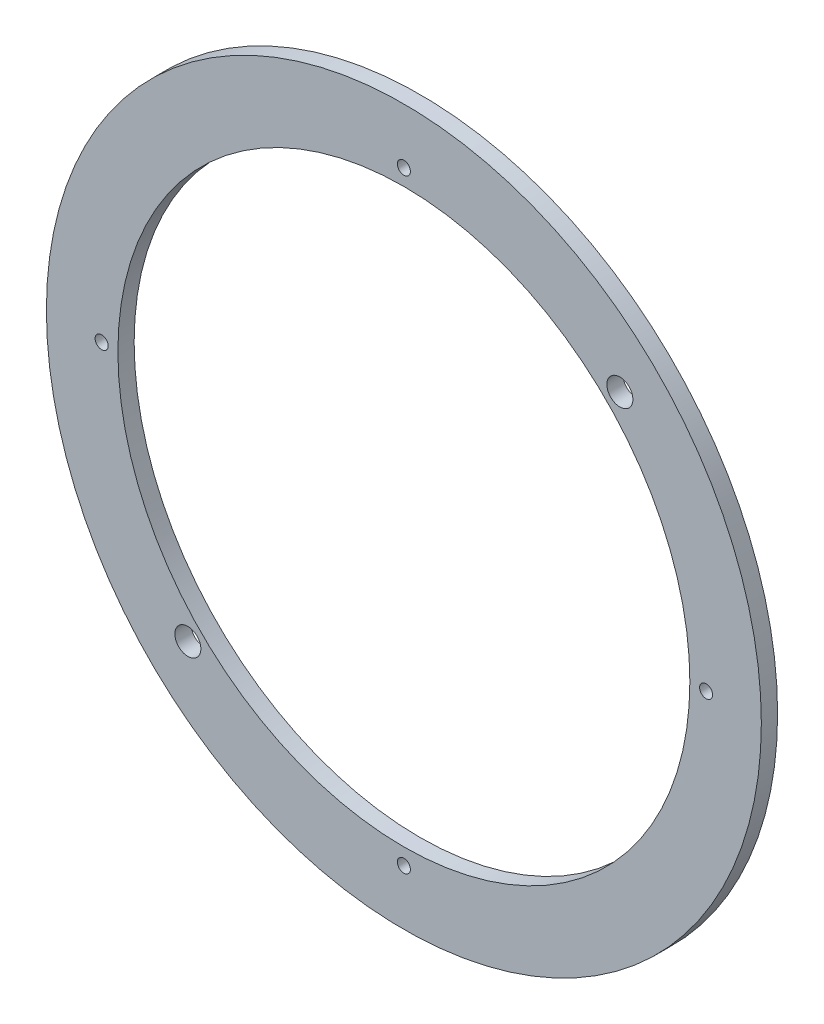
from build123d import *

# Parameters (mm, degrees)
SKETCH1_R           = 69.85
SKETCH1_R_2         = 55.88
BOSS_EXTRUDE1_DEPTH = 3.175
SKETCH4_R           = 1.27
SKETCH4_R_2         = 2.54
CUT_EXTRUDE2_DEPTH  = 108.317012813


with BuildPart() as part:
    # Sketch1 → Boss-Extrude1 (new body)
    with BuildSketch(Plane.XY):
        with Locations((-8.548720341, -3.365444156)):
            Circle(SKETCH1_R)
        with Locations((-8.548720341, -3.365444156)):
            Circle(SKETCH1_R_2, mode=Mode.SUBTRACT)
    extrude(amount=BOSS_EXTRUDE1_DEPTH)

    # Sketch4 → Cut-Extrude2 (cut, through all)
    with BuildSketch(Plane(origin=(0, 0, 0), x_dir=(-1, 0, 0), z_dir=(0, 0, -1))):
        with Locations((8.548720341, 55.689555844)):
            Circle(SKETCH4_R)
        with Locations((8.548720341, -62.420444156)):
            Circle(SKETCH4_R)
        with Locations((-50.506279659, -3.365444156)):
            Circle(SKETCH4_R)
        with Locations((67.603720341, -3.365444156)):
            Circle(SKETCH4_R)
        with Locations((-33.658483428, 38.841759613)):
            Circle(SKETCH4_R_2)
        with Locations((50.75592411, -45.572647925)):
            Circle(SKETCH4_R_2)
    extrude(amount=-CUT_EXTRUDE2_DEPTH, mode=Mode.SUBTRACT)


solid = part.part
